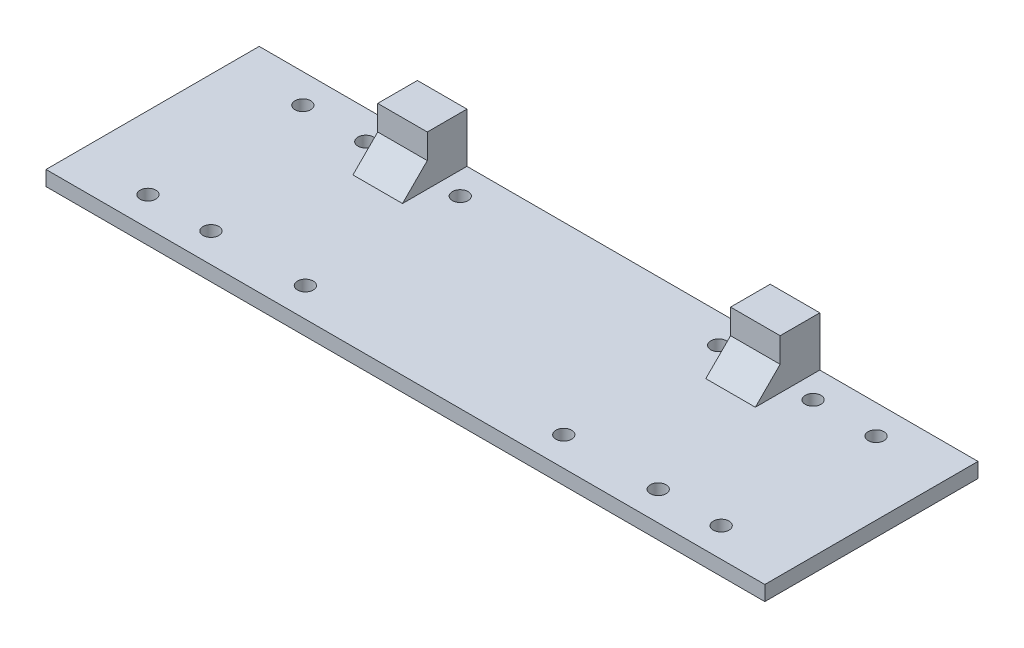
from build123d import *

# Parameters (mm, degrees)
SKETCH1_W           = 145
SKETCH1_H           = 43
SKETCH1_R           = 1.5875
BOSS_EXTRUDE1_DEPTH = 3
SKETCH4_W           = 10
SKETCH4_H           = 8
BOSS_EXTRUDE3_DEPTH = 10
CHAMFER2_SIZE       = 5
SKETCH5_R           = 2.2
CUT_EXTRUDE2_DEPTH  = 5.2


with BuildPart() as part:
    # Sketch1 → Boss-Extrude1 (new body)
    with BuildSketch(Plane(origin=(0, 0, 0), x_dir=(1, 0, 0), z_dir=(0, 1, 0))):
        Rectangle(SKETCH1_W, SKETCH1_H)
        with Locations(Location((-57.8125, 15.621, 0), (0, 0, 270))):
            Circle(SKETCH1_R, mode=Mode.SUBTRACT)
        with Locations(Location((-45.1125, 15.621, 0), (0, 0, 270))):
            Circle(SKETCH1_R, mode=Mode.SUBTRACT)
        with Locations(Location((-26.0625, 15.621, 0), (0, 0, 270))):
            Circle(SKETCH1_R, mode=Mode.SUBTRACT)
        with Locations(Location((-26.0625, -15.621, 0), (0, 0, 270))):
            Circle(SKETCH1_R, mode=Mode.SUBTRACT)
        with Locations(Location((-45.1125, -15.621, 0), (0, 0, 270))):
            Circle(SKETCH1_R, mode=Mode.SUBTRACT)
        with Locations(Location((-57.8125, -15.621, 0), (0, 0, 270))):
            Circle(SKETCH1_R, mode=Mode.SUBTRACT)
        with Locations(Location((45.1125, -15.621, 0), (0, 0, 90))):
            Circle(SKETCH1_R, mode=Mode.SUBTRACT)
        with Locations(Location((26.0625, -15.621, 0), (0, 0, 90))):
            Circle(SKETCH1_R, mode=Mode.SUBTRACT)
        with Locations(Location((26.0625, 15.621, 0), (0, 0, 90))):
            Circle(SKETCH1_R, mode=Mode.SUBTRACT)
        with Locations(Location((45.1125, 15.621, 0), (0, 0, 90))):
            Circle(SKETCH1_R, mode=Mode.SUBTRACT)
        with Locations(Location((57.8125, 15.621, 0), (0, 0, 90))):
            Circle(SKETCH1_R, mode=Mode.SUBTRACT)
        with Locations(Location((57.8125, -15.621, 0), (0, 0, 90))):
            Circle(SKETCH1_R, mode=Mode.SUBTRACT)
    extrude(amount=BOSS_EXTRUDE1_DEPTH)

    # Sketch4 → Boss-Extrude3 (add)
    with BuildSketch(Plane(origin=(0, 3, 0), x_dir=(1, 0, 0), z_dir=(0, 1, 0))):
        with Locations((-35.5875, 17.5)):
            Rectangle(SKETCH4_W, SKETCH4_H)
        with Locations((35.5875, 17.5)):
            Rectangle(SKETCH4_W, SKETCH4_H)
    extrude(amount=BOSS_EXTRUDE3_DEPTH)

    # Chamfer2
    chamfer2_edges = [part.edges().sort_by_distance(p)[0] for p in [
        (-35.5875, 3, -13.5),
        (35.5875, 3, -13.5),
    ]]
    chamfer(chamfer2_edges, length=CHAMFER2_SIZE)

    # Sketch5 → Cut-Extrude2 (cut)
    with BuildSketch(Plane(origin=(0, 0, -21.5), x_dir=(-1, 0, 0), z_dir=(0, 0, -1))):
        with Locations((-35.5875, 6.5)):
            Circle(SKETCH5_R)
        with Locations((35.5875, 6.5)):
            Circle(SKETCH5_R)
    extrude(amount=-CUT_EXTRUDE2_DEPTH, mode=Mode.SUBTRACT)


solid = part.part
